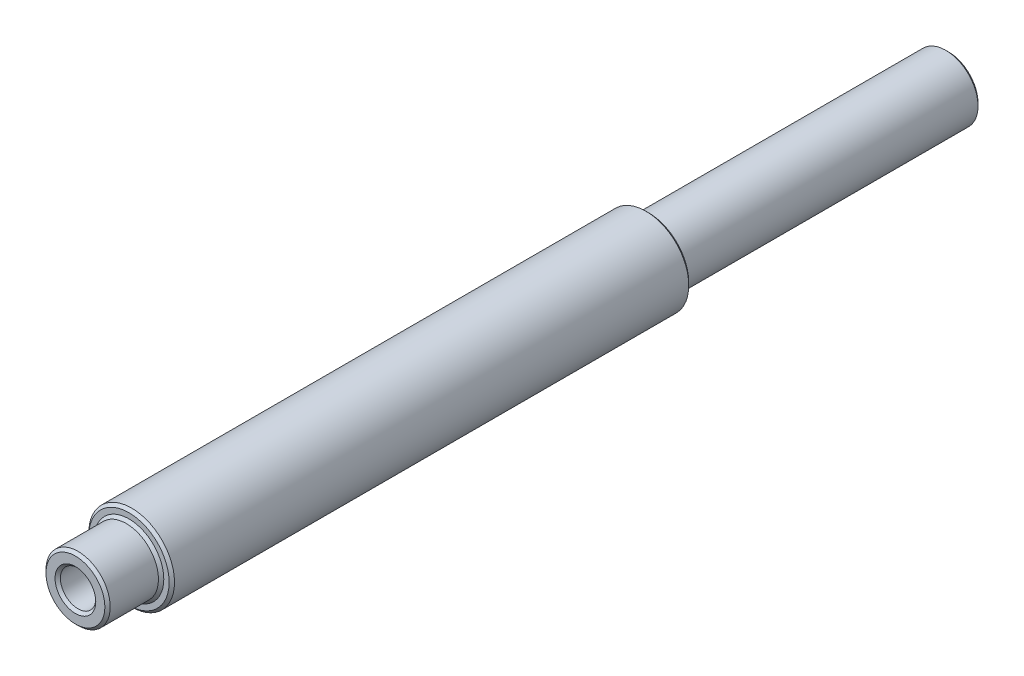
from build123d import *

# Parameters (mm, degrees)
ESQUISSE1_R           = 4
BOSS_EXTRU_1_DEPTH    = 81.5
ESQUISSE2_W           = 28
ESQUISSE2_H           = 1
ESQUISSE3_W           = 5
ESQUISSE3_H           = 1
TROU_TARAUD_M41_D     = 3.3
TROU_TARAUD_M41_DEPTH = 11.5
TROU_TARAUD_M41_TIP   = 0.991420021
TROU_TARAUD_M43_D     = 3.3
CHANFREIN1_SIZE       = 0.25


with BuildPart() as part:
    # Esquisse1 → Boss.-Extru.1 (new body)
    with BuildSketch(Plane.XY):
        Circle(ESQUISSE1_R)
    extrude(amount=BOSS_EXTRU_1_DEPTH)

    # Esquisse2 → Enlèvement de matière-Révolution1 (revolve, cut)
    with BuildSketch(Plane(origin=(0, 0, 0), x_dir=(0, 0, -1), z_dir=(1, 0, 0)), mode=Mode.PRIVATE) as enl_vement_de_mati_re_r_volution1_sk:
        with Locations((-14, 3.5)):
            Rectangle(ESQUISSE2_W, ESQUISSE2_H)
    revolve(enl_vement_de_mati_re_r_volution1_sk.sketch.rotate(Axis((0, 0, 0), (0, 0, 1)), 90), axis=Axis((0, 0, 0), (0, 0, 1)), mode=Mode.SUBTRACT)

    # Esquisse3 → Enlèvement de matière-Révolution2 (revolve, cut)
    with BuildSketch(Plane(origin=(0, 0, 0), x_dir=(0, 0, -1), z_dir=(1, 0, 0)), mode=Mode.PRIVATE) as enl_vement_de_mati_re_r_volution2_sk:
        with Locations((-79, 3.5)):
            Rectangle(ESQUISSE3_W, ESQUISSE3_H)
    revolve(enl_vement_de_mati_re_r_volution2_sk.sketch.rotate(Axis((0, 0, 81.5), (0, 0, -1)), 270), axis=Axis((0, 0, 81.5), (0, 0, -1)), mode=Mode.SUBTRACT)

    # Trou taraudé M41
    with Locations(Plane.XY.offset(81.5)):
        with Locations((0, 0)):
            Hole(TROU_TARAUD_M41_D / 2, depth=TROU_TARAUD_M41_DEPTH)
            with Locations((0, 0, -(TROU_TARAUD_M41_DEPTH + TROU_TARAUD_M41_TIP / 2))):  # 118° drill point
                Cone(0, TROU_TARAUD_M41_D / 2, TROU_TARAUD_M41_TIP, mode=Mode.SUBTRACT)

    # Trou taraudé M43 (through all)
    with Locations(Plane(origin=(0, 0, 0), x_dir=(-1, 0, 0), z_dir=(0, 0, -1))):
        with Locations((0, 0)):
            Hole(TROU_TARAUD_M43_D / 2)

    # Chanfrein1
    chanfrein1_edges = [part.edges().sort_by_distance(p)[0] for p in [
        (3, 0, 81.5),
        (3, 0, 76.5),
        (-4, 0, 76.5),
        (0, 1.65, 81.5),
        (-1.65, 0, 0),
        (3, 0, 0),
        (3, 0, 28),
        (-4, 0, 28),
    ]]
    chamfer(chanfrein1_edges, length=CHANFREIN1_SIZE)


solid = part.part
